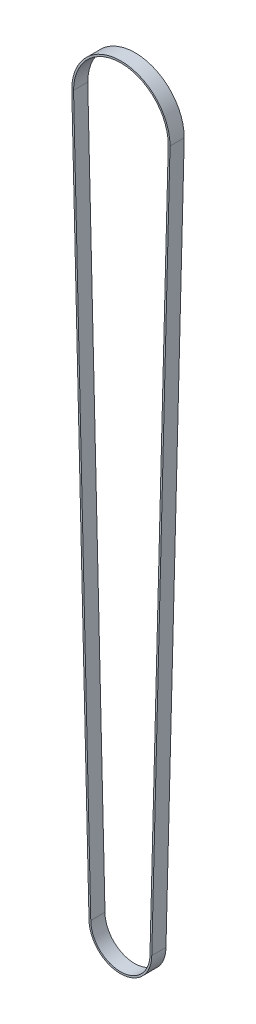
from build123d import *

# Parameters (mm, degrees)
BOSS_EXTRUDE5_DEPTH = 6


with BuildPart() as part:
    # Sketch3 → Boss-Extrude5 (new body)
    with BuildSketch(Plane.XY):
        with BuildLine():
            Line((-168.777888625, 409.385046093), (-161.497547073, 109.384997303))
            ThreePointArc((-161.497547073, 109.384997303), (-148.247551826, 96.144228908), (-134.997553507, 109.384994227))
            Line((-134.997553507, 109.384994227), (-127.277892942, 409.384492135))
            ThreePointArc((-127.277892942, 409.384492135), (-148.027613678, 430.144228906), (-168.777888625, 409.385046093))
        make_face()
        with BuildLine():
            Line((-168.027890657, 409.394228908), (-160.747550289, 109.394228908))
            ThreePointArc((-160.747550289, 109.394228908), (-148.247281326, 96.894228911), (-135.7475503, 109.394766833))
            Line((-135.7475503, 109.394766833), (-128.027890657, 409.394228908))
            ThreePointArc((-128.027890657, 409.394228908), (-148.027890657, 429.394228908), (-168.027890657, 409.394228908))
        make_face(mode=Mode.SUBTRACT)
    extrude(amount=BOSS_EXTRUDE5_DEPTH)


solid = part.part
